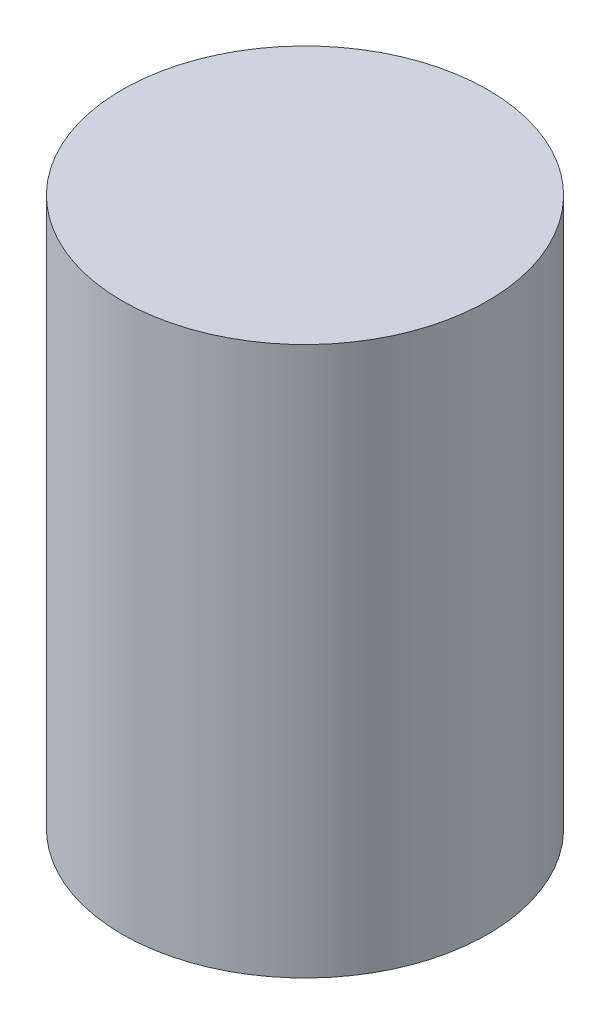
from build123d import *

# Parameters (mm, degrees)
SKETCH_1_R      = 10
EXTRUDE_1_DEPTH = 30


with BuildPart() as part:
    # 草图1 → 凸台-拉伸1 (new body)
    with BuildSketch(Plane(origin=(0, 0, 0), x_dir=(1, 0, 0), z_dir=(0, 1, 0))):
        with Locations(Location((0, 0, 0), (0, 0, 270))):
            Circle(SKETCH_1_R)
    extrude(amount=EXTRUDE_1_DEPTH)


solid = part.part
